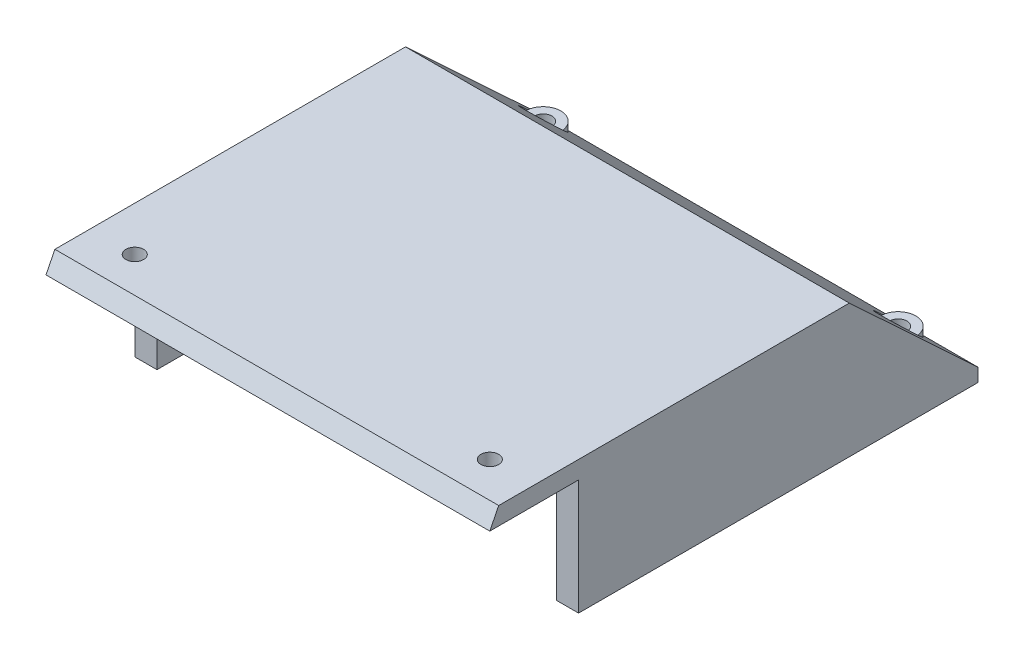
from build123d import *

# Parameters (mm, degrees)
BOSS_EXTRUDE1_DEPTH      = 3
BOSS_EXTRUDE2_DEPTH      = 3
SKETCH3_W                = 100
SKETCH3_H                = 4
BOSS_EXTRUDE3_DEPTH      = 20
CUT_EXTRUDE1_DEPTH       = 106
BOSS_EXTRUDE4_DEPTH      = 58
SKETCH6_W                = 100
SKETCH6_H                = 39.623225513
BOSS_EXTRUDE5_DEPTH      = 3
BOSS_EXTRUDE6_REACH      = 101.805
SKETCH7_W                = 4
SKETCH7_H                = 22.901045637
SKETCH10_R               = 2
CUT_EXTRUDE3_DEPTH       = 10
BOSS_EXTRUDE8_REACH      = 89.321
SKETCH12_R               = 2
CUT_EXTRUDE4_DEPTH       = 88.321245983
SKETCH13_W               = 90
SKETCH13_H               = 7
CUT_EXTRUDE5_DEPTH       = 3
CUT_EXTRUDE6_START       = -21
SKETCH15_R               = 4
SKETCH15_R_2             = 2
CUT_EXTRUDE6_DEPTH       = 21
BOSS_EXTRUDE9_DEPTH      = 1
BOSS_EXTRUDE9_DEPTH_BACK = 3
SKETCH16_R               = 4
SKETCH16_R_2             = 2
SKETCH17_W               = 83
SKETCH17_H               = 48.5
SKETCH17_W_2             = 77
SKETCH17_H_2             = 42.5
BOSS_EXTRUDE10_DEPTH     = 5


with BuildPart() as part:
    # Sketch1 → Boss-Extrude1 (new body)
    with BuildSketch(Plane(origin=(0, 0, 0), x_dir=(1, 0, 0), z_dir=(0, 1, 0))):
        Polygon((-50, 45), (50, 45), (50, -45), (45, -45), (45, 40), (-45, 40), (-45, -45), (-50, -45), align=None)
    extrude(amount=BOSS_EXTRUDE1_DEPTH)

    # Sketch2 → Boss-Extrude2 (add)
    with BuildSketch(Plane.XY.offset(45)):
        Polygon((-50, 3), (-50, 30), (50, 30), (50, 3), (45, 3), (45, 23), (-45, 23), (-45, 3), align=None)
    extrude(amount=-BOSS_EXTRUDE2_DEPTH)

    # Sketch3 → Boss-Extrude3 (add)
    with BuildSketch(Plane.XY.offset(45)):
        with Locations((0, 28)):
            Rectangle(SKETCH3_W, SKETCH3_H)
    extrude(amount=BOSS_EXTRUDE3_DEPTH)

    # Sketch4 → Cut-Extrude1 (cut)
    with BuildSketch(Plane(origin=(50, 0, 0), x_dir=(0, 0, -1), z_dir=(1, 0, 0))):
        Polygon((-65, 26), (-65, 30), (-63, 30), align=None)
    extrude(amount=-CUT_EXTRUDE1_DEPTH, mode=Mode.SUBTRACT)

    # Sketch5 → Boss-Extrude4 (add)
    with BuildSketch(Plane(origin=(0, 0, 42), x_dir=(-1, 0, 0), z_dir=(0, 0, -1))):
        Polygon((-50, 3), (-46, 3), (-46, 27), (46, 27), (46, 3), (50, 3), (50, 30), (-50, 30), align=None)
    extrude(amount=BOSS_EXTRUDE4_DEPTH)

    # Sketch6 → Boss-Extrude5 (add)
    with BuildSketch(Plane(origin=(0, 24.049681529, -22.391082803), x_dir=(-1, 0, 0), z_dir=(0, -0.7318939744313501, 0.6814185279188426))):
        with Locations((0, 11.07936051)):
            Rectangle(SKETCH6_W, SKETCH6_H)
    extrude(amount=BOSS_EXTRUDE5_DEPTH)

    # Sketch7 → Boss-Extrude6 (add, up to next)
    with BuildSketch(Plane(origin=(0, 0, -16), x_dir=(-1, 0, 0), z_dir=(0, 0, -1)), mode=Mode.PRIVATE) as boss_extrude6_sk1:
        with Locations((-48, 14.450522819)):
            Rectangle(SKETCH7_W, SKETCH7_H)
    boss_extrude6_tool1 = extrude(boss_extrude6_sk1.sketch, amount=BOSS_EXTRUDE6_REACH, mode=Mode.PRIVATE) - part.part
    # Sketch7 → Boss-Extrude6 (add, up to next)
    with BuildSketch(Plane(origin=(0, 0, -16), x_dir=(-1, 0, 0), z_dir=(0, 0, -1)), mode=Mode.PRIVATE) as boss_extrude6_sk2:
        with Locations((48, 14.450522819)):
            Rectangle(SKETCH7_W, SKETCH7_H)
    boss_extrude6_tool2 = extrude(boss_extrude6_sk2.sketch, amount=BOSS_EXTRUDE6_REACH, mode=Mode.PRIVATE) - part.part
    add(boss_extrude6_tool1.solids().sort_by_distance((48, 14.450523, -16))[0])
    add(boss_extrude6_tool2.solids().sort_by_distance((-48, 14.450523, -16))[0])

    # Sketch10 → Cut-Extrude3 (cut)
    with BuildSketch(Plane(origin=(0, 30, 0), x_dir=(1, 0, 0), z_dir=(0, 1, 0))):
        with Locations(Location((40, -55, 0), (0, 0, 180))):
            Circle(SKETCH10_R)
        with Locations(Location((-40, -55, 0), (0, 0, 180))):
            Circle(SKETCH10_R)
    extrude(amount=-CUT_EXTRUDE3_DEPTH, mode=Mode.SUBTRACT)

    # Boss-Extrude8: up to this plane
    boss_extrude8_end = Plane(origin=(0, 21.853999605, -20.346827219), z_dir=(0, -0.7318939744313501, 0.6814185279188426))
    # Sketch11 → Boss-Extrude8 (add, up to the surface)
    with BuildSketch(Plane.XZ, mode=Mode.PRIVATE) as boss_extrude8_sk1:
        with BuildLine():
            Line((-40, -33), (-48.829023615, -33))
            Line((-48.829023615, -33), (-48.829023615, -41))
            Line((-48.829023615, -41), (-40, -41))
            ThreePointArc((-40, -41), (-36, -37), (-40, -33))
        make_face()
    boss_extrude8_tool1 = split(extrude(boss_extrude8_sk1.sketch, amount=-BOSS_EXTRUDE8_REACH, mode=Mode.PRIVATE), bisect_by=boss_extrude8_end, keep=Keep.BOTH, mode=Mode.PRIVATE)
    add(boss_extrude8_tool1.solids().sort_by_distance((-42.810423, 0, -37))[0])
    # Sketch11 → Boss-Extrude8 (add, up to the surface)
    with BuildSketch(Plane.XZ, mode=Mode.PRIVATE) as boss_extrude8_sk2:
        with BuildLine():
            Line((40, -33), (48.614584002, -33))
            Line((48.614584002, -33), (48.614584002, -41))
            Line((48.614584002, -41), (40, -41))
            ThreePointArc((40, -41), (36, -37), (40, -33))
        make_face()
    boss_extrude8_tool2 = split(extrude(boss_extrude8_sk2.sketch, amount=-BOSS_EXTRUDE8_REACH, mode=Mode.PRIVATE), bisect_by=boss_extrude8_end, keep=Keep.BOTH, mode=Mode.PRIVATE)
    add(boss_extrude8_tool2.solids().sort_by_distance((42.702596, 0, -37))[0])

    # Sketch12 → Cut-Extrude4 (cut, through all)
    with BuildSketch(Plane.XZ):
        with Locations(Location((-40, -37, 0), (0, 0, 270))):
            Circle(SKETCH12_R)
        with Locations(Location((40, -37, 0), (0, 0, 270))):
            Circle(SKETCH12_R)
    extrude(amount=-CUT_EXTRUDE4_DEPTH, mode=Mode.SUBTRACT)

    # Sketch13 → Cut-Extrude5 (cut)
    with BuildSketch(Plane.XZ):
        with Locations((0, -36.5)):
            Rectangle(SKETCH13_W, SKETCH13_H)
    extrude(amount=-CUT_EXTRUDE5_DEPTH, mode=Mode.SUBTRACT)

    # Sketch15 → Cut-Extrude6 (cut)
    # profile 1 of 2: a face of its own
    with BuildSketch(Plane(origin=(0, 30, 0), x_dir=(1, 0, 0), z_dir=(0, 1, 0)).offset(CUT_EXTRUDE6_START)):
        with Locations((-40, 37)):
            Circle(SKETCH15_R)
        with Locations(Location((-40, 37, 0), (0, 0, 90))):
            Circle(SKETCH15_R_2, mode=Mode.SUBTRACT)
    # profile 2 of 2: a face of its own
    with BuildSketch(Plane(origin=(0, 30, 0), x_dir=(1, 0, 0), z_dir=(0, 1, 0)).offset(CUT_EXTRUDE6_START)):
        with Locations((40, 37)):
            Circle(SKETCH15_R)
        with Locations(Location((40, 37, 0), (0, 0, 90))):
            Circle(SKETCH15_R_2, mode=Mode.SUBTRACT)
    extrude(amount=CUT_EXTRUDE6_DEPTH, mode=Mode.SUBTRACT)

    # Sketch16 → Boss-Extrude9 (add, two sides: drawn at the far end of the back side and taken through both)
    # profile 1 of 2: a face of its own
    with BuildSketch(Plane(origin=(0, 9, 0), x_dir=(1, 0, 0), z_dir=(0, 1, 0)).offset(-BOSS_EXTRUDE9_DEPTH_BACK)):
        with Locations((-40, 37)):
            Circle(SKETCH16_R)
        with Locations(Location((-40, 37, 0), (0, 0, 90))):
            Circle(SKETCH16_R_2, mode=Mode.SUBTRACT)
    # profile 2 of 2: a face of its own
    with BuildSketch(Plane(origin=(0, 9, 0), x_dir=(1, 0, 0), z_dir=(0, 1, 0)).offset(-BOSS_EXTRUDE9_DEPTH_BACK)):
        with Locations((40, 37)):
            Circle(SKETCH16_R)
        with Locations(Location((40, 37, 0), (0, 0, 90))):
            Circle(SKETCH16_R_2, mode=Mode.SUBTRACT)
    extrude(amount=BOSS_EXTRUDE9_DEPTH + BOSS_EXTRUDE9_DEPTH_BACK)

    # Sketch17 → Boss-Extrude10 (add)
    with BuildSketch(Plane.XZ.offset(-27)):
        with Locations((0, 9.534179837)):
            Rectangle(SKETCH17_W, SKETCH17_H)
        with Locations((0, 9.534179837)):
            Rectangle(SKETCH17_W_2, SKETCH17_H_2, mode=Mode.SUBTRACT)
    extrude(amount=BOSS_EXTRUDE10_DEPTH)


solid = part.part
